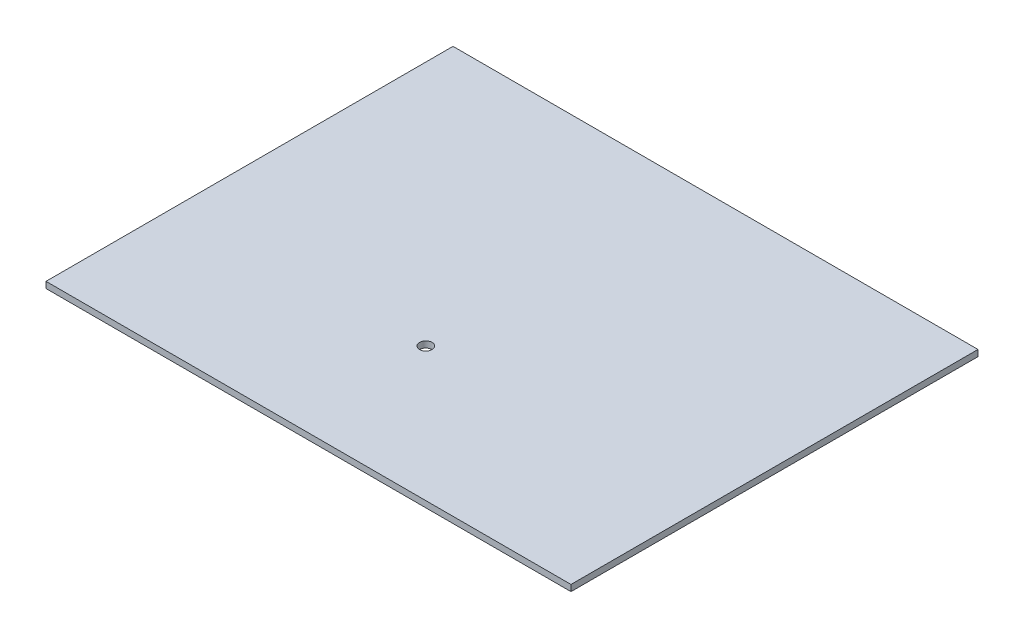
from build123d import *

# Parameters (mm, degrees)
SKETCH_3_W          = 167.68
SKETCH_3_H          = 130
EXTRUDE_1_DEPTH     = 2
SKETCH_5_R          = 2
CUT_EXTRUDE_1_DEPTH = 2
SKETCH_6_W          = 10
SKETCH_6_H          = 19.7733087
EXTRUDE_2_DEPTH     = 3


with BuildPart() as part:
    # 스케치3 → 보스-돌출1 (new body)
    with BuildSketch(Plane.XZ.offset(15)):
        with Locations((38.84, -35)):
            Rectangle(SKETCH_3_W, SKETCH_3_H)
    extrude(amount=EXTRUDE_1_DEPTH)

    # 스케치5 → 컷-돌출1 (cut)
    with BuildSketch(Plane.XZ.offset(17)):
        with Locations((33.535545215, -12.778353339)):
            Circle(SKETCH_5_R)
    extrude(amount=-CUT_EXTRUDE_1_DEPTH, mode=Mode.SUBTRACT)

    # 스케치6 → 보스-돌출2 (add)
    with BuildSketch(Plane.XZ.offset(17)):
        with Locations((0, -59.389009604)):
            Rectangle(SKETCH_6_W, SKETCH_6_H)
        with Locations((25, -59.389009604)):
            Rectangle(SKETCH_6_W, SKETCH_6_H)
        with Locations((50, -59.389009604)):
            Rectangle(SKETCH_6_W, SKETCH_6_H)
        with Locations((75, -59.389009604)):
            Rectangle(SKETCH_6_W, SKETCH_6_H)
    extrude(amount=EXTRUDE_2_DEPTH)


solid = part.part
